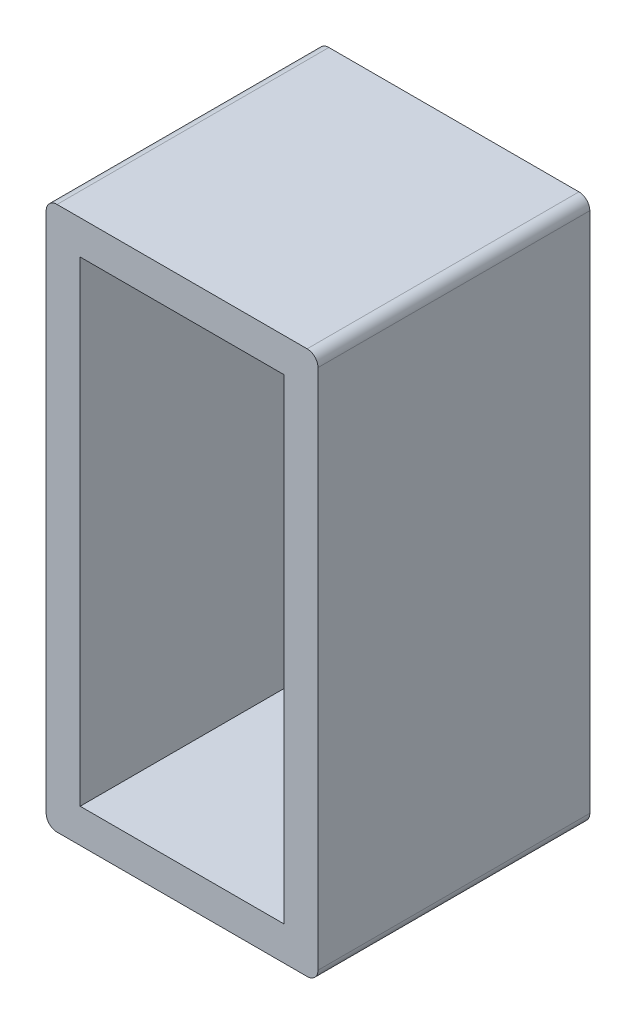
from build123d import *

# Parameters (mm, degrees)
SKETCH1_W           = 19.05
SKETCH1_H           = 44.45
BOSS_EXTRUDE1_DEPTH = 12.7


with BuildPart() as part:
    # Sketch1 → Boss-Extrude1 (new, symmetric)
    with BuildSketch(Plane.XY):
        with BuildLine():
            Line((-11.684, -25.4), (11.684, -25.4))
            ThreePointArc((11.684, -25.4), (12.40242049, -25.10242049), (12.7, -24.384))
            Line((12.7, -24.384), (12.7, 24.384))
            ThreePointArc((12.7, 24.384), (12.40242049, 25.10242049), (11.684, 25.4))
            Line((11.684, 25.4), (-11.684, 25.4))
            ThreePointArc((-11.684, 25.4), (-12.40242049, 25.10242049), (-12.7, 24.384))
            Line((-12.7, 24.384), (-12.7, -24.384))
            ThreePointArc((-12.7, -24.384), (-12.40242049, -25.10242049), (-11.684, -25.4))
        make_face()
        Rectangle(SKETCH1_W, SKETCH1_H, mode=Mode.SUBTRACT)
    extrude(amount=BOSS_EXTRUDE1_DEPTH, both=True)


solid = part.part
